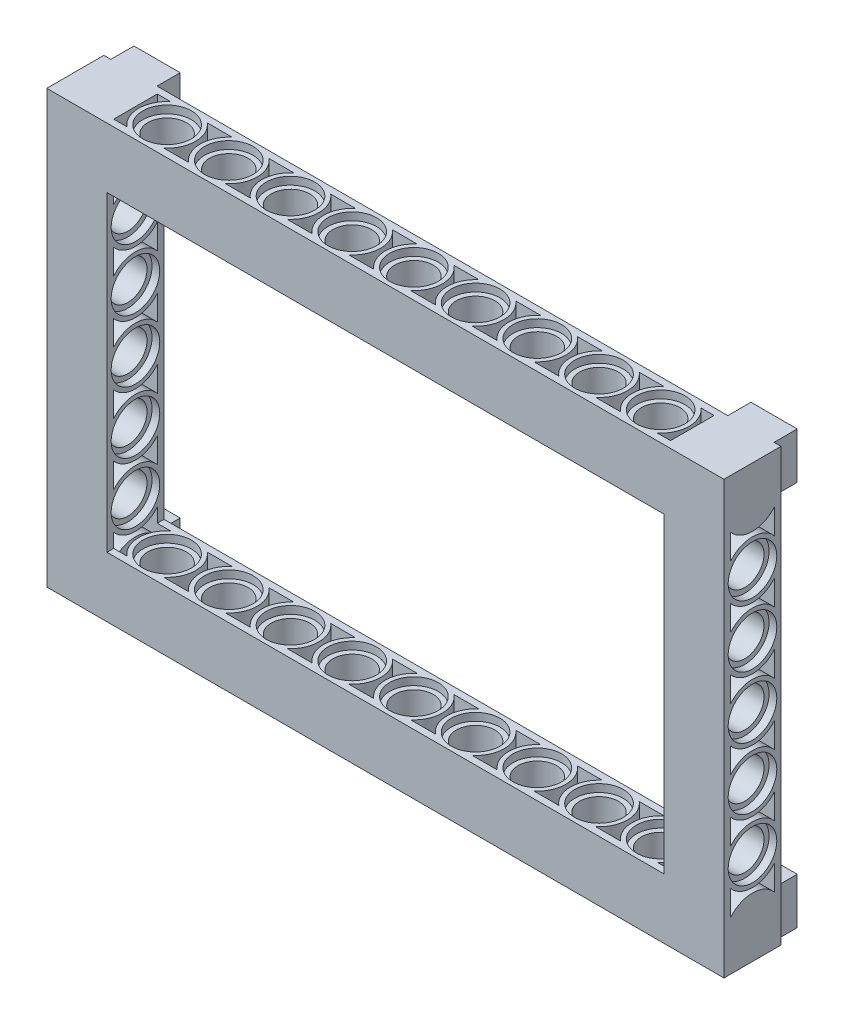
from build123d import *

# Parameters (mm, degrees)
SKETCH_1_W             = 6
SKETCH_1_H             = 6
SKETCH_1_R             = 0.8
EXTRUDE_1_DEPTH        = 3
EXTRUDE_1_2_DEPTH      = 3
EXTRUDE_START          = 0.9
SKETCH_2_W             = 7.4
SKETCH_2_H             = 56
EXTRUDE_3_DEPTH        = 7.8
CUT_EXTRUDE_START      = 0.9
SKETCH_3_R             = 2.5
CUT_EXTRUDE_1_DEPTH    = 7.8
SKETCH_3_3_R           = 3.15
CUT_EXTRUDE_2_DEPTH    = 1
CUT_EXTRUDE_START_2    = -6.9
SKETCH_3_4_R           = 3.15
SKETCH_3_4_R_2         = 2.5
CUT_EXTRUDE_3_DEPTH    = 1
PATTERN_LINEAR_1_COUNT = 3
PATTERN_LINEAR_1_PITCH = 8
PATTERN_LINEAR_2_COUNT = 3
PATTERN_LINEAR_2_PITCH = 8
CUT_EXTRUDE_4_DEPTH    = 2
CUT_EXTRUDE_5_DEPTH    = 2
PATTERN_LINEAR_3_COUNT = 3
PATTERN_LINEAR_3_PITCH = 8
PATTERN_LINEAR_4_COUNT = 4
PATTERN_LINEAR_4_PITCH = 8
EXTRUDE_5_DEPTH        = 7.8
CUT_EXTRUDE_6_DEPTH    = 2
CUT_EXTRUDE_START_3    = -7.8
CUT_EXTRUDE_7_DEPTH    = 2
SKETCH_7_6_R           = 3.15
SKETCH_7_6_R_2         = 2.5
CUT_EXTRUDE_8_DEPTH    = 1
SKETCH_7_7_R           = 3.15
SKETCH_7_7_R_2         = 2.5
CUT_EXTRUDE_9_DEPTH    = 1
CUT_EXTRUDE_10_REACH   = 73.912
SKETCH_7_8_R           = 2.5
PATTERN_LINEAR_5_COUNT = 9
PATTERN_LINEAR_5_PITCH = 8
PATTERN_LINEAR_6_COUNT = 10
PATTERN_LINEAR_6_PITCH = 8


with BuildPart() as part:
    # 草图1 → 凸台-拉伸1 (new body)
    with BuildSketch(Plane.XY):
        with Locations((-40, -25)):
            Rectangle(SKETCH_1_W, SKETCH_1_H)
        with Locations((-40, -25)):
            Circle(SKETCH_1_R, mode=Mode.SUBTRACT)
    extrude(amount=EXTRUDE_1_DEPTH)


with BuildPart() as body_2:
    # 草图1 → Extrude 1 2 (new body)
    with BuildSketch(Plane.XY):
        with Locations((-40, 25)):
            Rectangle(SKETCH_1_W, SKETCH_1_H)
        with Locations((-40, 25)):
            Circle(SKETCH_1_R, mode=Mode.SUBTRACT)
    extrude(amount=EXTRUDE_1_2_DEPTH)

    # 草图2 → 凸台-拉伸3 (add)
    with BuildSketch(Plane.ZY.offset(43).offset(EXTRUDE_START)):
        with Locations((6.7, 0)):
            Rectangle(SKETCH_2_W, SKETCH_2_H)
    extrude(amount=-EXTRUDE_3_DEPTH)

    # 草图3 → 切除-拉伸1 (cut)
    with BuildSketch(Plane.ZY.offset(43).offset(CUT_EXTRUDE_START)):
        with Locations(Location((6.7, 0, 0), (0, 0, 180))):
            Circle(SKETCH_3_R)
    cut_extrude_1 = extrude(amount=-CUT_EXTRUDE_1_DEPTH, mode=Mode.SUBTRACT)

    # 草图3<3> → 切除-拉伸2 (cut)
    with BuildSketch(Plane.ZY.offset(43).offset(CUT_EXTRUDE_START)):
        with Locations(Location((6.7, 0, 0), (0, 0, 180))):
            Circle(SKETCH_3_3_R)
    cut_extrude_2 = extrude(amount=-CUT_EXTRUDE_2_DEPTH, mode=Mode.SUBTRACT)

    # 草图3<4> → 切除-拉伸3 (cut)
    with BuildSketch(Plane.ZY.offset(43).offset(CUT_EXTRUDE_START_2)):
        with Locations(Location((6.7, 0, 0), (0, 0, 180))):
            Circle(SKETCH_3_4_R)
        with Locations(Location((6.7, 0, 0), (0, 0, 180))):
            Circle(SKETCH_3_4_R_2, mode=Mode.SUBTRACT)
    cut_extrude_3 = extrude(amount=CUT_EXTRUDE_3_DEPTH, mode=Mode.SUBTRACT)

    # 阵列(线性)1: 切除-拉伸1, 切除-拉伸2, 切除-拉伸3 ×3
    with Locations(*[(0, i * PATTERN_LINEAR_1_PITCH, 0) for i in range(1, PATTERN_LINEAR_1_COUNT)]):
        add(cut_extrude_1, mode=Mode.SUBTRACT)
        add(cut_extrude_2, mode=Mode.SUBTRACT)
        add(cut_extrude_3, mode=Mode.SUBTRACT)

    # 阵列(线性)2: 切除-拉伸1, 切除-拉伸2, 切除-拉伸3 ×3
    with Locations(*[(0, -i * PATTERN_LINEAR_2_PITCH, 0) for i in range(1, PATTERN_LINEAR_2_COUNT)]):
        add(cut_extrude_1, mode=Mode.SUBTRACT)
        add(cut_extrude_2, mode=Mode.SUBTRACT)
        add(cut_extrude_3, mode=Mode.SUBTRACT)

    # 草图3<5> → 切除-拉伸4 (cut)
    with BuildSketch(Plane.ZY.offset(43).offset(CUT_EXTRUDE_START)):
        with BuildLine():
            Line((3.875, 5.610570152), (3.875, 2.389429848))
            ThreePointArc((3.875, 2.389429848), (6.7, 3.7), (9.525, 2.389429848))
            Line((9.525, 2.389429848), (9.525, 5.610570152))
            ThreePointArc((9.525, 5.610570152), (6.7, 4.3), (3.875, 5.610570152))
        make_face()
    cut_extrude_4 = extrude(amount=-CUT_EXTRUDE_4_DEPTH, mode=Mode.SUBTRACT)

    # 草图3<6> → 切除-拉伸5 (cut)
    with BuildSketch(Plane.ZY.offset(43).offset(CUT_EXTRUDE_START_2)):
        with BuildLine():
            Line((3.875, 5.610570152), (3.875, 2.389429848))
            ThreePointArc((3.875, 2.389429848), (6.7, 3.7), (9.525, 2.389429848))
            Line((9.525, 2.389429848), (9.525, 5.610570152))
            ThreePointArc((9.525, 5.610570152), (6.7, 4.3), (3.875, 5.610570152))
        make_face()
    cut_extrude_5 = extrude(amount=CUT_EXTRUDE_5_DEPTH, mode=Mode.SUBTRACT)

    # 阵列(线性)3: 切除-拉伸4, 切除-拉伸5 ×3
    with Locations(*[(0, i * PATTERN_LINEAR_3_PITCH, 0) for i in range(1, PATTERN_LINEAR_3_COUNT)]):
        add(cut_extrude_4, mode=Mode.SUBTRACT)
        add(cut_extrude_5, mode=Mode.SUBTRACT)

    # 阵列(线性)4: 切除-拉伸4, 切除-拉伸5 ×4
    with Locations(*[(0, -i * PATTERN_LINEAR_4_PITCH, 0) for i in range(1, PATTERN_LINEAR_4_COUNT)]):
        add(cut_extrude_4, mode=Mode.SUBTRACT)
        add(cut_extrude_5, mode=Mode.SUBTRACT)


with BuildPart() as body_3:
    # 镜向6: mirrored copy
    add(body_2.part.mirror(Plane(origin=(0, 0, 0), x_dir=(0, 0, 1), z_dir=(1, 0, 0))))


with BuildPart() as body_4:
    # Mirror 6 2: mirrored copy
    add(part.part.mirror(Plane(origin=(0, 0, 0), x_dir=(0, 0, 1), z_dir=(1, 0, 0))))


with BuildPart() as part_1:
    add(part.part)

    add(body_2.part)  # 凸台-拉伸5 merges body 2

    add(body_3.part)  # 凸台-拉伸5 merges body 3

    add(body_4.part)  # 凸台-拉伸5 merges body 4
    # 草图7 → 凸台-拉伸5 (add)
    with BuildSketch(Plane.XZ.offset(28)):
        with BuildLine():
            ThreePointArc((-40, 10.4), (-36.3, 6.7), (-40, 3))
            Line((-40, 3), (40, 3))
            Line((40, 3), (40, 10.4))
            Line((40, 10.4), (-40, 10.4))
        make_face()
    extrude(amount=-EXTRUDE_5_DEPTH)

    # 草图7<4> → 切除-拉伸6 (cut)
    with BuildSketch(Plane.XZ.offset(28)):
        with BuildLine():
            Line((-34.389429848, 9.525), (-37.610570152, 9.525))
            ThreePointArc((-37.610570152, 9.525), (-36.643596386, 8.257098192), (-36.3, 6.7))
            ThreePointArc((-36.3, 6.7), (-36.643596386, 5.142901808), (-37.610570152, 3.875))
            Line((-37.610570152, 3.875), (-34.389429848, 3.875))
            ThreePointArc((-34.389429848, 3.875), (-35.7, 6.7), (-34.389429848, 9.525))
        make_face()
    cut_extrude_6 = extrude(amount=-CUT_EXTRUDE_6_DEPTH, mode=Mode.SUBTRACT)

    # 草图7<5> → 切除-拉伸7 (cut)
    with BuildSketch(Plane.XZ.offset(28).offset(CUT_EXTRUDE_START_3)):
        with BuildLine():
            Line((-34.389429848, 9.525), (-37.610570152, 9.525))
            ThreePointArc((-37.610570152, 9.525), (-36.643596386, 8.257098192), (-36.3, 6.7))
            ThreePointArc((-36.3, 6.7), (-36.643596386, 5.142901808), (-37.610570152, 3.875))
            Line((-37.610570152, 3.875), (-34.389429848, 3.875))
            ThreePointArc((-34.389429848, 3.875), (-35.7, 6.7), (-34.389429848, 9.525))
        make_face()
    cut_extrude_7 = extrude(amount=CUT_EXTRUDE_7_DEPTH, mode=Mode.SUBTRACT)

    # 草图7<6> → 切除-拉伸8 (cut)
    with BuildSketch(Plane.XZ.offset(28)):
        with Locations(Location((-32, 6.7, 0), (0, 0, 270))):
            Circle(SKETCH_7_6_R)
        with Locations(Location((-32, 6.7, 0), (0, 0, 270))):
            Circle(SKETCH_7_6_R_2, mode=Mode.SUBTRACT)
    cut_extrude_8 = extrude(amount=-CUT_EXTRUDE_8_DEPTH, mode=Mode.SUBTRACT)

    # 草图7<7> → 切除-拉伸9 (cut)
    with BuildSketch(Plane.XZ.offset(28).offset(CUT_EXTRUDE_START_3)):
        with Locations(Location((-32, 6.7, 0), (0, 0, 270))):
            Circle(SKETCH_7_7_R)
        with Locations(Location((-32, 6.7, 0), (0, 0, 270))):
            Circle(SKETCH_7_7_R_2, mode=Mode.SUBTRACT)
    cut_extrude_9 = extrude(amount=CUT_EXTRUDE_9_DEPTH, mode=Mode.SUBTRACT)

    # 草图7<8> → 切除-拉伸10 (cut, up to next)
    with BuildSketch(Plane.XZ.offset(28), mode=Mode.PRIVATE) as cut_extrude_10_sk1:
        with Locations(Location((-32, 6.7, 0), (0, 0, 270))):
            Circle(SKETCH_7_8_R)
    cut_extrude_10_tool1 = extrude(cut_extrude_10_sk1.sketch, amount=-CUT_EXTRUDE_10_REACH, mode=Mode.PRIVATE) & part_1.part
    cut_extrude_10 = cut_extrude_10_tool1.solids().sort_by_distance((-32, -28, 6.7))[0]
    add(cut_extrude_10, mode=Mode.SUBTRACT)

    # 阵列(线性)5: 切除-拉伸8, 切除-拉伸9, 切除-拉伸10 ×9
    with Locations(*[(i * PATTERN_LINEAR_5_PITCH, 0, 0) for i in range(1, PATTERN_LINEAR_5_COUNT)]):
        add(cut_extrude_8, mode=Mode.SUBTRACT)
        add(cut_extrude_9, mode=Mode.SUBTRACT)
        add(cut_extrude_10, mode=Mode.SUBTRACT)

    # 阵列(线性)6: 切除-拉伸6, 切除-拉伸7 ×10
    with Locations(*[(i * PATTERN_LINEAR_6_PITCH, 0, 0) for i in range(1, PATTERN_LINEAR_6_COUNT)]):
        add(cut_extrude_6, mode=Mode.SUBTRACT)
        add(cut_extrude_7, mode=Mode.SUBTRACT)

    # 镜向8: part across plane


with BuildPart() as part_2:
    add(part_1.part)
    add(part_1.part.mirror(Plane.ZX))


solid = part_2.part
